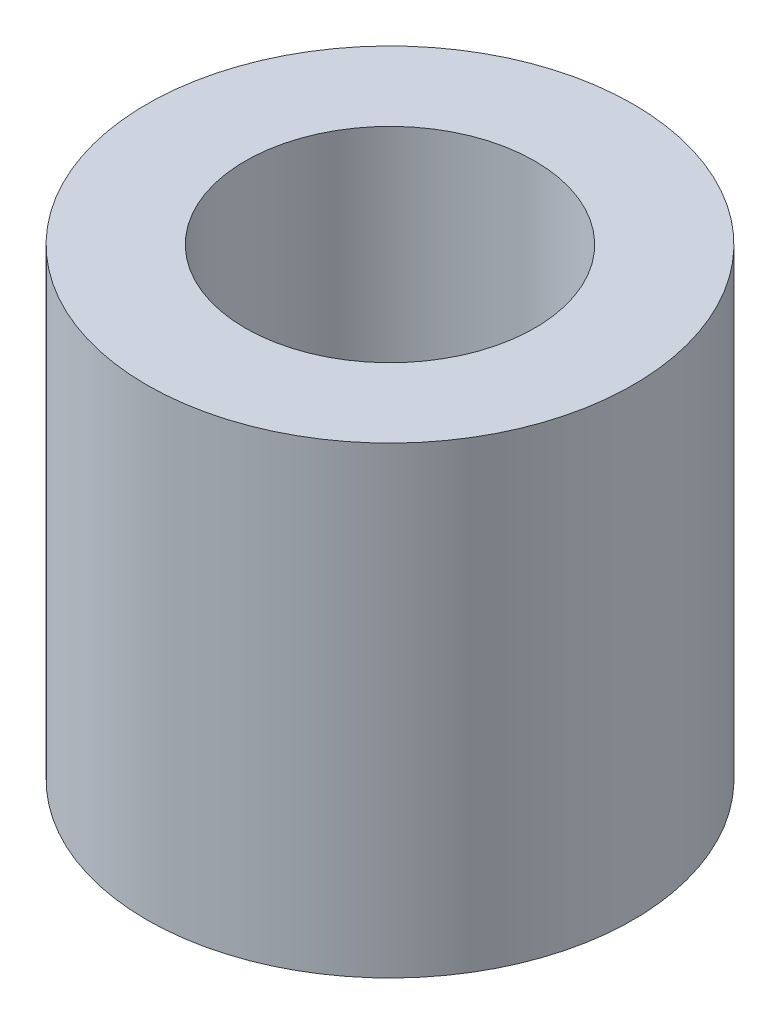
from build123d import *

# Parameters (mm, degrees)
SKETCH_1_R        = 2.1
EXTRUDE_1_DEPTH   = 4
HOLE_WIZARD_M31_D = 2.5


with BuildPart() as part:
    # Эскиз1 → Бобышка-Вытянуть1 (new body)
    with BuildSketch(Plane(origin=(0, 0, 0), x_dir=(1, 0, 0), z_dir=(0, 1, 0))):
        with Locations(Location((0, 0, 0), (0, 0, 270))):
            Circle(SKETCH_1_R)
    extrude(amount=EXTRUDE_1_DEPTH)

    # Отверстие обработанное метчиком M31 (through all)
    with Locations(Plane(origin=(0, 4, 0), x_dir=(1, 0, 0), z_dir=(0, 1, 0))):
        with Locations((0, 0)):
            Hole(HOLE_WIZARD_M31_D / 2)


solid = part.part
